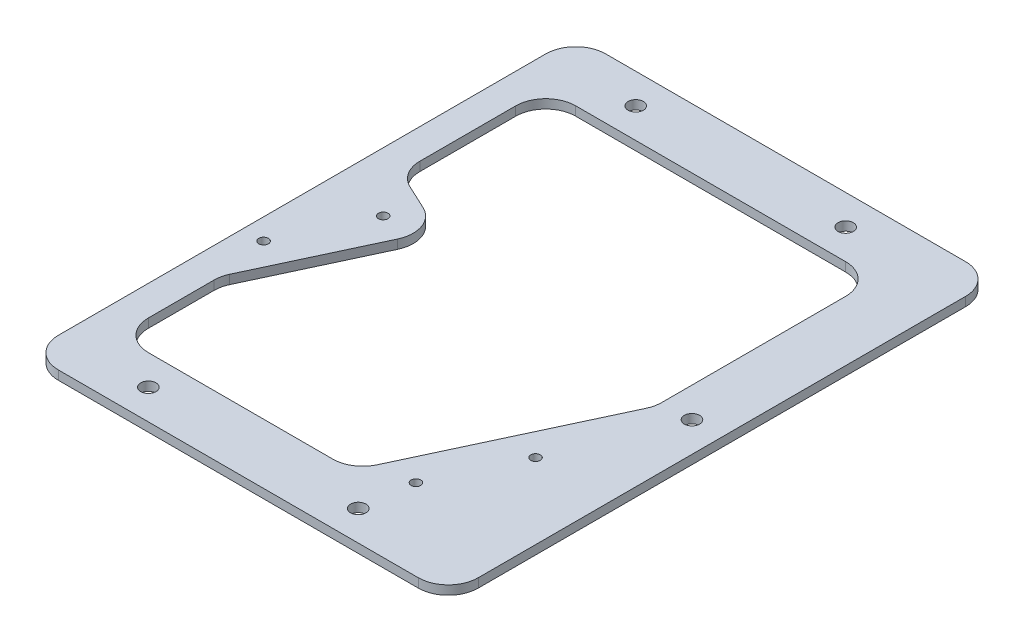
from build123d import *

# Parameters (mm, degrees)
SKETCH_1_W          = 140
SKETCH_1_H          = 182.5
SKETCH_1_R          = 2.55
EXTRUDE_1_DEPTH     = 3
FILLET_1_R          = 10
SKETCH_2_R          = 1.6
CUT_EXTRUDE_1_DEPTH = 116.045914747
CUT_EXTRUDE_2_DEPTH = 116.045914747
FILLET_2_R          = 10


with BuildPart() as part:
    # ｽｹｯﾁ1 → ﾎﾞｽ - 押し出し1 (new body)
    with BuildSketch(Plane(origin=(0, 0, 0), x_dir=(1, 0, 0), z_dir=(0, 1, 0))):
        Rectangle(SKETCH_1_W, SKETCH_1_H)
        with Locations(Location((-40, 81.25, 0), (0, 0, 270))):
            Circle(SKETCH_1_R, mode=Mode.SUBTRACT)
        with Locations(Location((30, 81.25, 0), (0, 0, 270))):
            Circle(SKETCH_1_R, mode=Mode.SUBTRACT)
        with Locations(Location((60, 0, 0), (0, 0, 270))):
            Circle(SKETCH_1_R, mode=Mode.SUBTRACT)
        with Locations(Location((-40, -81.25, 0), (0, 0, 270))):
            Circle(SKETCH_1_R, mode=Mode.SUBTRACT)
        with Locations(Location((30, -81.25, 0), (0, 0, 270))):
            Circle(SKETCH_1_R, mode=Mode.SUBTRACT)
    extrude(amount=EXTRUDE_1_DEPTH)

    # ﾌｨﾚｯﾄ1
    fillet_1_edges = [part.edges().sort_by_distance(p)[0] for p in [
        (70, 1.5, 91.25),
        (-70, 1.5, 91.25),
        (-70, 1.5, -91.25),
        (70, 1.5, -91.25),
    ]]
    fillet(fillet_1_edges, radius=FILLET_1_R)

    # ｽｹｯﾁ2 → ｶｯﾄ - 押し出し1 (cut, through all)
    with BuildSketch(Plane(origin=(0, 3, 0), x_dir=(1, 0, 0), z_dir=(0, 1, 0))):
        with Locations(Location((-50.304962764, 7.366722093, 0), (0, 0, 270))):
            Circle(SKETCH_2_R)
        with Locations(Location((-62.983510616, -19.822511518, 0), (0, 0, 270))):
            Circle(SKETCH_2_R)
        with Locations(Location((44.857354875, -37.008195389, 0), (0, 0, 270))):
            Circle(SKETCH_2_R)
        with Locations(Location((32.178807023, -64.197429, 0), (0, 0, 270))):
            Circle(SKETCH_2_R)
    extrude(amount=-CUT_EXTRUDE_1_DEPTH, mode=Mode.SUBTRACT)

    # ｽｹｯﾁ3 → ｶｯﾄ - 押し出し2 (cut, through all)
    with BuildSketch(Plane(origin=(0, 3, 0), x_dir=(1, 0, 0), z_dir=(0, 1, 0))):
        Polygon((-60, 71.25), (50, 71.25), (50, -2.317741498), (17.856359967, -71.25), (-60, -71.25), (-60, -37.086368186), (-37.015702276, 12.203617346), (-60, 22.921371393), align=None)
    extrude(amount=-CUT_EXTRUDE_2_DEPTH, mode=Mode.SUBTRACT)

    # ﾌｨﾚｯﾄ2
    fillet_2_edges = [part.edges().sort_by_distance(p)[0] for p in [
        (-60, 1.5, -22.921371393),
        (-60, 1.5, -71.25),
        (50, 1.5, -71.25),
        (50, 1.5, 2.317741498),
        (17.856359967, 1.5, 71.25),
        (-60, 1.5, 71.25),
        (-60, 1.5, 37.086368186),
        (-37.015702276, 1.5, -12.203617346),
    ]]
    fillet(fillet_2_edges, radius=FILLET_2_R)


solid = part.part
